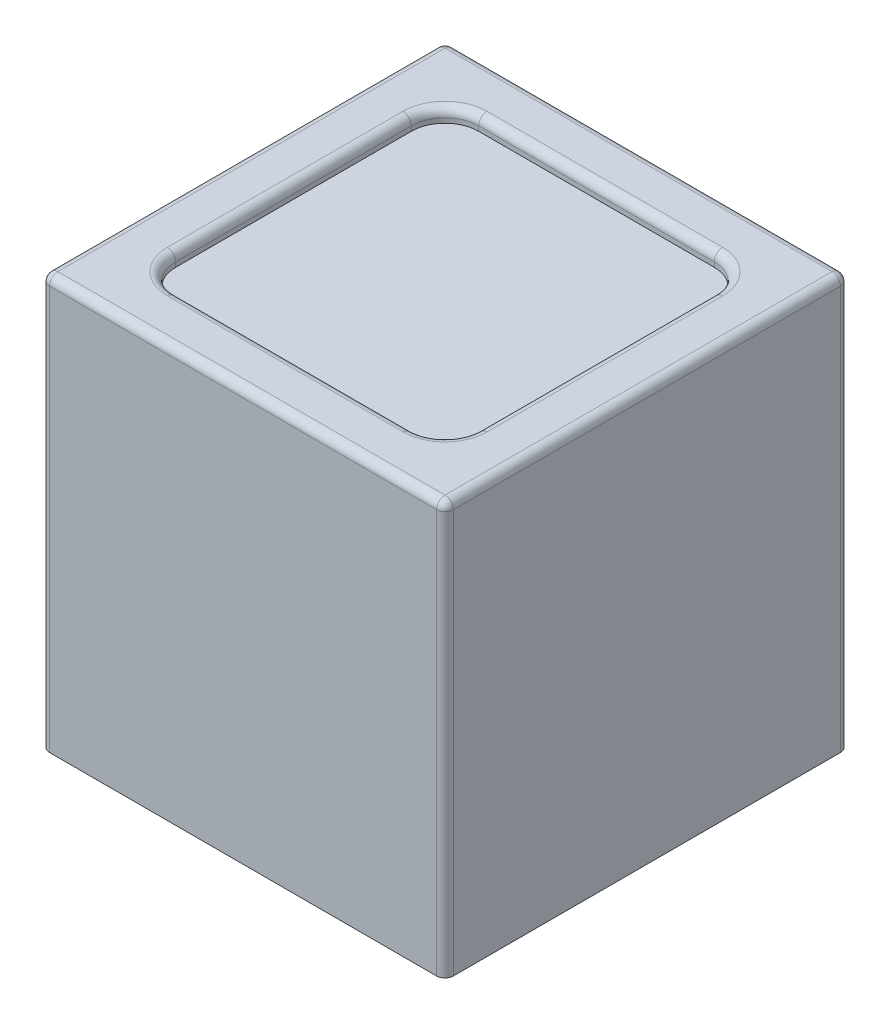
from build123d import *

# Parameters (mm, degrees)
SKETCH_1_W          = 240
SKETCH_1_H          = 240
SKETCH_1_W_2        = 220
SKETCH_1_H_2        = 220
EXTRUDE_1_DEPTH     = 230
SKETCH_2_W          = 240
SKETCH_2_H          = 240
EXTRUDE_1_2_DEPTH   = 15
SKETCH_5_W          = 240
SKETCH_5_H          = 240
EXTRUDE_3_DEPTH     = 230
FILLET_1_R          = 5
FILLET_2_R          = 5
CUT_EXTRUDE_2_DEPTH = 230
SKETCH_9_W          = 214.264204386
SKETCH_9_H          = 2.717939168
EXTRUDE_5_DEPTH     = 235
FILLET_3_R          = 5


with BuildPart() as part:
    # 草图1 → Extrude 1 (new body)
    with BuildSketch(Plane(origin=(0, 0, 0), x_dir=(1, 0, 0), z_dir=(0, 1, 0))):
        Rectangle(SKETCH_1_W, SKETCH_1_H)
        Rectangle(SKETCH_1_W_2, SKETCH_1_H_2, mode=Mode.SUBTRACT)
    extrude(amount=EXTRUDE_1_DEPTH)

    # 草图2 → Extrude 1 2 (add)
    with BuildSketch(Plane(origin=(0, 230, 0), x_dir=(1, 0, 0), z_dir=(0, 1, 0))):
        Rectangle(SKETCH_2_W, SKETCH_2_H)
    extrude(amount=EXTRUDE_1_2_DEPTH)

    # 草图5 → 凸台-拉伸3 (add)
    with BuildSketch(Plane.XZ.offset(-230)):
        Rectangle(SKETCH_5_W, SKETCH_5_H)
        with BuildLine():
            Line((-90, 110), (90, 110))
            ThreePointArc((90, 110), (104.142135624, 104.142135624), (110, 90))
            Line((110, 90), (110, -90))
            ThreePointArc((110, -90), (104.142135624, -104.142135624), (90, -110))
            Line((90, -110), (-90, -110))
            ThreePointArc((-90, -110), (-104.142135624, -104.142135624), (-110, -90))
            Line((-110, -90), (-110, 90))
            ThreePointArc((-110, 90), (-104.142135624, 104.142135624), (-90, 110))
        make_face(mode=Mode.SUBTRACT)
    extrude(amount=EXTRUDE_3_DEPTH)

    # 圆角1
    fillet_1_edges = [part.edges().sort_by_distance(p)[0] for p in [
        (-120, 245, 0),
        (0, 245, 120),
        (120, 245, 0),
        (0, 245, -120),
        (120, 122.5, 120),
        (-120, 122.5, 120),
        (-120, 122.5, -120),
        (120, 122.5, -120),
    ]]
    fillet(fillet_1_edges, radius=FILLET_1_R)

    # 圆角2
    fillet_2_edges = [part.edges().sort_by_distance(p)[0] for p in [
        (0, 230, -110),
        (110, 230, 0),
        (0, 230, 110),
        (-110, 230, 0),
        (104.142135624, 230, -104.142135624),
        (-104.142135624, 230, -104.142135624),
        (-104.142135624, 230, 104.142135624),
        (104.142135624, 230, 104.142135624),
    ]]
    fillet(fillet_2_edges, radius=FILLET_2_R)

    # 草图6 → 切除-拉伸2 (cut)
    with BuildSketch(Plane(origin=(0, 245, 0), x_dir=(1, 0, 0), z_dir=(0, 1, 0))):
        with BuildLine():
            Line((-70, -90), (70, -90))
            ThreePointArc((70, -90), (84.142135624, -84.142135624), (90, -70))
            Line((90, -70), (90, 70))
            ThreePointArc((90, 70), (84.142135624, 84.142135624), (70, 90))
            Line((70, 90), (-70, 90))
            ThreePointArc((-70, 90), (-84.142135624, 84.142135624), (-90, 70))
            Line((-90, 70), (-90, -70))
            ThreePointArc((-90, -70), (-84.142135624, -84.142135624), (-70, -90))
        make_face()
    extrude(amount=-CUT_EXTRUDE_2_DEPTH, mode=Mode.SUBTRACT)

    # 圆角3
    fillet_3_edges = [part.edges().sort_by_distance(p)[0] for p in [
        (-84.142135624, 230, 84.142135624),
        (-90, 230, 0),
        (-84.142135624, 230, -84.142135624),
        (0, 230, -90),
        (84.142135624, 230, -84.142135624),
        (90, 230, 0),
        (84.142135624, 230, 84.142135624),
        (0, 230, 90),
        (-84.142135624, 245, 84.142135624),
        (0, 245, 90),
        (84.142135624, 245, 84.142135624),
        (90, 245, 0),
        (84.142135624, 245, -84.142135624),
        (0, 245, -90),
        (-84.142135624, 245, -84.142135624),
        (-90, 245, 0),
    ]]
    fillet(fillet_3_edges, radius=FILLET_3_R)


with BuildPart() as body_2:
    # 草图9 → 凸台-拉伸5 (new body)
    with BuildSketch(Plane(origin=(0, 0, -120), x_dir=(-1, 0, 0), z_dir=(0, 0, -1))):
        with Locations((0, 235.860712786)):
            Rectangle(SKETCH_9_W, SKETCH_9_H)
    extrude(amount=-EXTRUDE_5_DEPTH)


solid = Compound([part.part, body_2.part])
